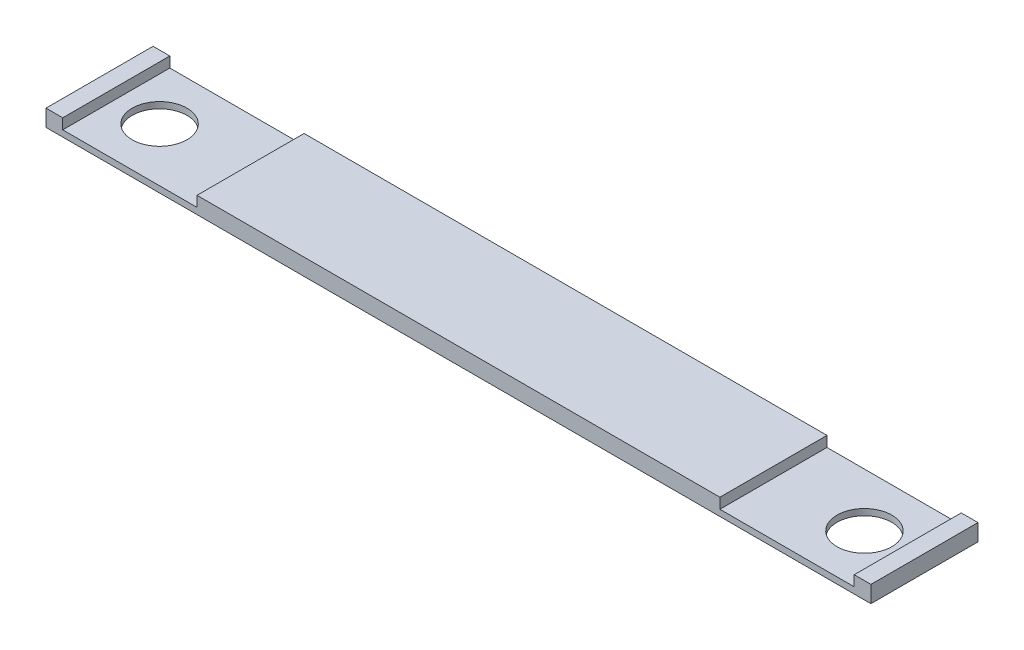
from build123d import *

# Parameters (mm, degrees)
SKETCH1_W           = 197.2
SKETCH1_H           = 25.6
SKETCH1_R           = 6.55
BOSS_EXTRUDE1_DEPTH = 1.5
SKETCH3_W           = 125
SKETCH3_H           = 25.6
SKETCH3_W_2         = 4
BOSS_EXTRUDE3_DEPTH = 2.5


with BuildPart() as part:
    # Sketch1 → Boss-Extrude1 (new body)
    with BuildSketch(Plane(origin=(0, 0, 0), x_dir=(1, 0, 0), z_dir=(0, 1, 0))):
        Rectangle(SKETCH1_W, SKETCH1_H)
        with Locations(Location((-84.25, 0, 0), (0, 0, 270))):
            Circle(SKETCH1_R, mode=Mode.SUBTRACT)
        with Locations(Location((84.25, 0, 0), (0, 0, 270))):
            Circle(SKETCH1_R, mode=Mode.SUBTRACT)
    extrude(amount=BOSS_EXTRUDE1_DEPTH)

    # Sketch3 → Boss-Extrude3 (add)
    with BuildSketch(Plane(origin=(0, 1.5, 0), x_dir=(1, 0, 0), z_dir=(0, 1, 0))):
        Rectangle(SKETCH3_W, SKETCH3_H)
        with Locations((-96.6, 0)):
            Rectangle(SKETCH3_W_2, SKETCH3_H)
        with Locations((96.6, 0)):
            Rectangle(SKETCH3_W_2, SKETCH3_H)
    extrude(amount=BOSS_EXTRUDE3_DEPTH)


solid = part.part
